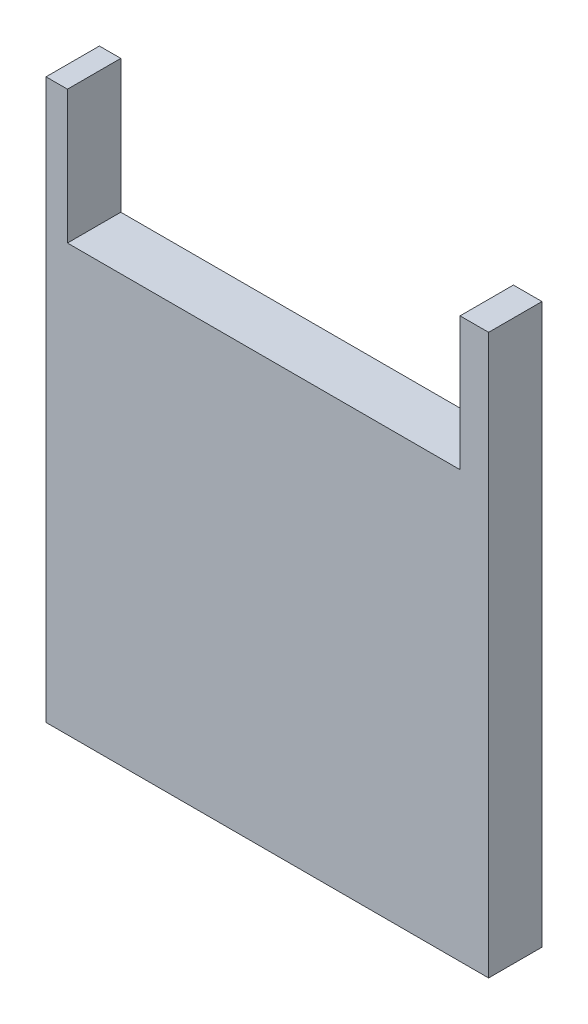
from build123d import *

# Parameters (mm, degrees)
BOSS_EXTRUDE1_DEPTH = 6


with BuildPart() as part:
    # Sketch1 → Boss-Extrude1 (new body)
    with BuildSketch(Plane.XY):
        Polygon((19.001883861, -24.889791536), (-27.566113206, -24.889791536), (-27.566113206, 38.003767721), (-25.157423703, 38.003767721), (-25.157423703, 23.016366366), (19.001883861, 23.016366366), (19.001883861, 38.003767721), (22.213469865, 38.003767721), (22.213469865, -24.889791536), align=None)
    extrude(amount=BOSS_EXTRUDE1_DEPTH)


solid = part.part
